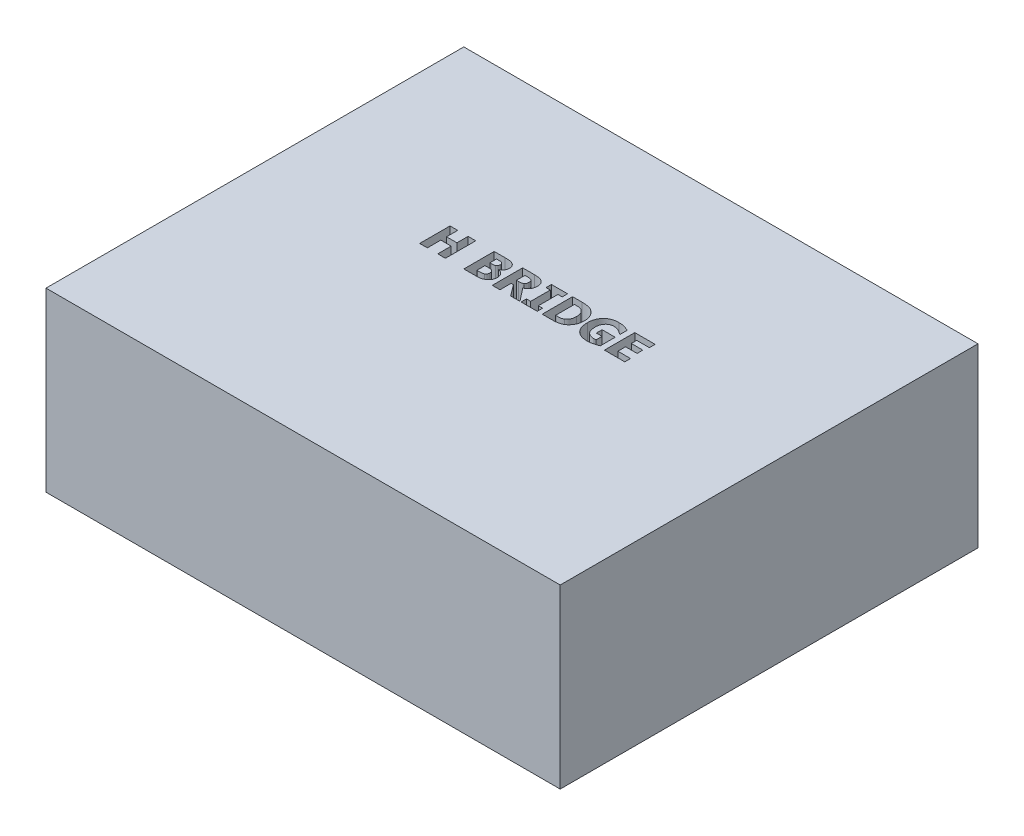
from build123d import *

# Parameters (mm, degrees)
SKETCH1_W           = 64
SKETCH1_H           = 52
BOSS_EXTRUDE1_DEPTH = 22
CUT_EXTRUDE1_DEPTH  = 5


with BuildPart() as part:
    # Sketch1 → Boss-Extrude1 (new body)
    with BuildSketch(Plane(origin=(0, 0, 0), x_dir=(1, 0, 0), z_dir=(0, 1, 0))):
        Rectangle(SKETCH1_W, SKETCH1_H)
    extrude(amount=BOSS_EXTRUDE1_DEPTH)

    # Sketch2 → Cut-Extrude1 (cut)
    # profile 1 of 7: a face of its own
    with BuildSketch(Plane(origin=(0, 22, 0), x_dir=(1, 0, 0), z_dir=(0, 1, 0))):
        Polygon((-10.357455958, 2.069627509), (-11.313535369, 2.069627509), (-11.313535369, 3.742766478), (-12.604242573, 3.742766478), (-12.604242573, 2.069627509), (-13.560321984, 2.069627509), (-13.560321984, 5.846141181), (-12.604242573, 5.846141181), (-12.604242573, 4.459826036), (-11.313535369, 4.459826036), (-11.313535369, 5.846141181), (-10.357455958, 5.846141181), align=None)
    # profile 2 of 7: a face of its own
    with BuildSketch(Plane(origin=(0, 22, 0), x_dir=(1, 0, 0), z_dir=(0, 1, 0))):
        with BuildLine():
            add(Edge.make_bspline(
                [(-5.051215229, 3.235596228), (-5.052531204, 3.189721844), (-5.055096883, 3.100283262), (-5.074311597, 2.97025612), (-5.10830409, 2.849045976), (-5.154514397, 2.736729844), (-5.212548958, 2.633772128), (-5.280221165, 2.540128014), (-5.356158117, 2.454578318), (-5.414327991, 2.406059899), (-5.443357175, 2.381847192)],
                knots=[0, 0, 0, 0, 1.130445661, 2.203963237, 3.229787093, 4.225774451, 5.190144825, 6.135328208, 7.069451278, 8, 8, 8, 8], degree=3))
            add(Edge.make_bspline(
                [(-5.443357175, 2.381847192), (-5.479174189, 2.354911476), (-5.549971715, 2.301669126), (-5.665150184, 2.2359779), (-5.784602746, 2.180856133), (-5.911948827, 2.138610859), (-6.050253744, 2.106939579), (-6.203415327, 2.085349713), (-6.373798449, 2.071846766), (-6.493024809, 2.070390938), (-6.555546427, 2.069627509)],
                knots=[0, 0, 0, 0, 0.91099212, 1.800708127, 2.691591466, 3.583856334, 4.525105797, 5.57463143, 6.728150668, 8, 8, 8, 8], degree=3))
            Line((-6.555546427, 2.069627509), (-8.062865373, 2.069627509))
            Line((-8.062865373, 2.069627509), (-8.062865373, 5.846141181))
            Line((-8.062865373, 5.846141181), (-6.727341946, 5.846141181))
            add(Edge.make_bspline(
                [(-6.727341946, 5.846141181), (-6.693729267, 5.84594937), (-6.628492719, 5.845577096), (-6.533875904, 5.844100068), (-6.44548491, 5.84183092), (-6.363544082, 5.839077432), (-6.287812437, 5.834771262), (-6.218668294, 5.828335835), (-6.15555645, 5.822910819), (-6.080117896, 5.812890663), (-5.991087544, 5.796229325), (-5.888117715, 5.767634733), (-5.788309031, 5.73073681), (-5.725167221, 5.698625414), (-5.693581083, 5.68256197)],
                knots=[0, 0, 0, 0, 1.143520417, 2.219380531, 3.219197627, 4.15154526, 5.008552699, 5.799198733, 6.513922521, 7.163213148, 8.387543574, 9.591785181, 10.795311644, 12, 12, 12, 12], degree=3))
            add(Edge.make_bspline(
                [(-5.693581083, 5.68256197), (-5.661437999, 5.663697312), (-5.598750611, 5.626906314), (-5.515026853, 5.559049282), (-5.446206202, 5.480201898), (-5.388609703, 5.393779324), (-5.344690767, 5.299143608), (-5.313183699, 5.197418861), (-5.293113569, 5.089039928), (-5.291207047, 5.014142838), (-5.290235082, 4.97595953)],
                knots=[0, 0, 0, 0, 1.041847095, 2.031873272, 2.999091578, 3.959286096, 4.928433905, 5.906626674, 6.932776715, 8, 8, 8, 8], degree=3))
            add(Edge.make_bspline(
                [(-5.290235082, 4.97595953), (-5.291618842, 4.93149973), (-5.294341721, 4.844014433), (-5.321641351, 4.717086137), (-5.364286407, 4.597057265), (-5.424691225, 4.486289112), (-5.500274809, 4.386584552), (-5.589326887, 4.300216717), (-5.692124609, 4.228761291), (-5.768401256, 4.194252072), (-5.807115513, 4.176736898)],
                knots=[0, 0, 0, 0, 1.052709469, 2.071457828, 3.062941266, 4.064024921, 5.049816461, 6.018313633, 6.994193899, 8, 8, 8, 8], degree=3))
            Line((-5.807115513, 4.176736898), (-5.807115513, 4.156569598))
            add(Edge.make_bspline(
                [(-5.807115513, 4.156569598), (-5.779103846, 4.150053372), (-5.724006925, 4.137236428), (-5.644626213, 4.110447731), (-5.569287311, 4.080297151), (-5.498324183, 4.044839507), (-5.431649665, 4.004348494), (-5.368979549, 3.959112695), (-5.311242085, 3.908367713), (-5.257069801, 3.854090596), (-5.20853296, 3.794449248), (-5.166174886, 3.729382625), (-5.130502778, 3.659237703), (-5.101258591, 3.584169303), (-5.078863858, 3.504062067), (-5.062578878, 3.419141589), (-5.052649954, 3.328950731), (-5.051701587, 3.267242474), (-5.051215229, 3.235596228)],
                knots=[0, 0, 0, 0, 1.057746791, 2.080511354, 3.079231932, 4.042133923, 4.99592611, 5.947074256, 6.882246053, 7.821672012, 8.766088789, 9.70636327, 10.673397439, 11.656829387, 12.66616828, 13.72992954, 14.835825053, 16, 16, 16, 16], degree=3))
        make_face()
        with BuildLine():
            add(Edge.make_bspline(
                [(-6.246314493, 4.795200767), (-6.246906398, 4.810681443), (-6.24811866, 4.842386913), (-6.257718309, 4.889883438), (-6.271707794, 4.938451787), (-6.292641745, 4.985889198), (-6.317917539, 5.032051031), (-6.351619402, 5.071692822), (-6.392448465, 5.104119156), (-6.423269745, 5.119649374), (-6.439024249, 5.127587749)],
                knots=[0, 0, 0, 0, 0.915395731, 1.874792295, 2.858433124, 3.90120845, 4.937405344, 5.961802946, 6.958161907, 8, 8, 8, 8], degree=3))
            add(Edge.make_bspline(
                [(-6.439024249, 5.127587749), (-6.455064342, 5.134238004), (-6.487974662, 5.147882687), (-6.541635362, 5.160659161), (-6.599324042, 5.169715682), (-6.663294049, 5.173905722), (-6.737053069, 5.174544494), (-6.824436106, 5.176482063), (-6.927520672, 5.177012491), (-7.001468014, 5.176929841), (-7.041055503, 5.176885594)],
                knots=[0, 0, 0, 0, 0.684378048, 1.404175102, 2.169995346, 2.98777272, 3.931378651, 5.081316863, 6.437491725, 8, 8, 8, 8], degree=3))
            Line((-7.041055503, 5.176885594), (-7.106785962, 5.176885594))
            Line((-7.106785962, 5.176885594), (-7.106785962, 4.364218095))
            Line((-7.106785962, 4.364218095), (-6.988022973, 4.364218095))
            add(Edge.make_bspline(
                [(-6.988022973, 4.364218095), (-6.950425732, 4.364053005), (-6.881452008, 4.363750141), (-6.787096062, 4.365616458), (-6.711142129, 4.367019496), (-6.633276691, 4.368843672), (-6.544729388, 4.382754276), (-6.480163763, 4.409354464), (-6.446493619, 4.423226121)],
                knots=[0, 0, 0, 0, 1.231390467, 2.259037774, 3.090997842, 3.719401835, 4.810697381, 6, 6, 6, 6], degree=3))
            add(Edge.make_bspline(
                [(-6.446493619, 4.423226121), (-6.428397518, 4.432537466), (-6.393724156, 4.450378638), (-6.350022519, 4.486685697), (-6.313347151, 4.526264808), (-6.288248412, 4.573286644), (-6.270245443, 4.623671428), (-6.2550702, 4.67714812), (-6.248431816, 4.735033458), (-6.247033256, 4.77477589), (-6.246314493, 4.795200767)],
                knots=[0, 0, 0, 0, 1.083723435, 2.076487952, 3.018522984, 3.947228666, 4.898232103, 5.875647137, 6.908228701, 8, 8, 8, 8], degree=3))
        make_face(mode=Mode.SUBTRACT)
        with BuildLine():
            add(Edge.make_bspline(
                [(-6.00729464, 3.250534969), (-6.008033416, 3.279732135), (-6.00943777, 3.335233625), (-6.023099608, 3.413271802), (-6.044014962, 3.482170678), (-6.076305749, 3.540748174), (-6.116982496, 3.591595619), (-6.166863841, 3.634738872), (-6.225092512, 3.672194636), (-6.268633275, 3.69016096), (-6.291130715, 3.69944413)],
                knots=[0, 0, 0, 0, 1.223025523, 2.324874161, 3.311999707, 4.227644879, 5.111309446, 6.028560024, 6.981360234, 8, 8, 8, 8], degree=3))
            add(Edge.make_bspline(
                [(-6.291130715, 3.69944413), (-6.306712278, 3.705025544), (-6.340058006, 3.716970194), (-6.395534206, 3.728290768), (-6.45900488, 3.735599285), (-6.531372955, 3.738596938), (-6.614043625, 3.740771599), (-6.708664475, 3.742212382), (-6.815977119, 3.742932788), (-6.891916904, 3.742823937), (-6.932002695, 3.742766478)],
                knots=[0, 0, 0, 0, 0.614957564, 1.316055911, 2.099415238, 2.989610622, 4.00862425, 5.175571169, 6.509088967, 8, 8, 8, 8], degree=3))
            Line((-6.932002695, 3.742766478), (-7.106785962, 3.742766478))
            Line((-7.106785962, 3.742766478), (-7.106785962, 2.738883097))
            Line((-7.106785962, 2.738883097), (-7.055994243, 2.738883097))
            add(Edge.make_bspline(
                [(-7.055994243, 2.738883097), (-7.02636585, 2.738905737), (-6.969598845, 2.738949114), (-6.887931051, 2.738652829), (-6.813239508, 2.739639985), (-6.745517038, 2.740329489), (-6.685014337, 2.741057215), (-6.631734901, 2.741880314), (-6.585659692, 2.74237682), (-6.533539972, 2.744269777), (-6.472350176, 2.7496336), (-6.400097128, 2.764106642), (-6.326841657, 2.785585825), (-6.279483532, 2.806086299), (-6.255277737, 2.816564549)],
                knots=[0, 0, 0, 0, 1.314396541, 2.518339591, 3.622929724, 4.628117177, 5.522858632, 6.307156197, 6.992056909, 7.566839726, 8.620846177, 9.712605044, 10.830861409, 12, 12, 12, 12], degree=3))
            add(Edge.make_bspline(
                [(-6.255277737, 2.816564549), (-6.234751703, 2.827168241), (-6.194952304, 2.847728499), (-6.142292354, 2.887984475), (-6.099065772, 2.935629855), (-6.065619255, 2.990290935), (-6.039322655, 3.049619413), (-6.020954485, 3.113217875), (-6.009250299, 3.180640456), (-6.007957858, 3.226831802), (-6.00729464, 3.250534969)],
                knots=[0, 0, 0, 0, 1.044175691, 2.024627102, 2.982012005, 3.938799849, 4.912493031, 5.910912324, 6.927981141, 8, 8, 8, 8], degree=3))
        make_face(mode=Mode.SUBTRACT)
    # profile 3 of 7: a face of its own
    with BuildSketch(Plane(origin=(0, 22, 0), x_dir=(1, 0, 0), z_dir=(0, 1, 0))):
        with BuildLine():
            Line((-1.083485675, 2.069627509), (-2.236009527, 2.069627509))
            Line((-2.236009527, 2.069627509), (-3.273505075, 3.455942655))
            Line((-3.273505075, 3.455942655), (-3.569292143, 3.455942655))
            Line((-3.569292143, 3.455942655), (-3.569292143, 2.069627509))
            Line((-3.569292143, 2.069627509), (-4.525371553, 2.069627509))
            Line((-4.525371553, 2.069627509), (-4.525371553, 5.846141181))
            Line((-4.525371553, 5.846141181), (-3.018052608, 5.846141181))
            add(Edge.make_bspline(
                [(-3.018052608, 5.846141181), (-2.96774983, 5.845792138), (-2.870569594, 5.84511782), (-2.729756344, 5.837677564), (-2.598958114, 5.824870991), (-2.476807647, 5.808282863), (-2.361340395, 5.78421533), (-2.251810705, 5.747512207), (-2.145946369, 5.701977743), (-2.080006715, 5.662643086), (-2.047034456, 5.642974307)],
                knots=[0, 0, 0, 0, 1.199793894, 2.317889013, 3.362092139, 4.333845176, 5.257590495, 6.170331022, 7.085098041, 8, 8, 8, 8], degree=3))
            add(Edge.make_bspline(
                [(-2.047034456, 5.642974307), (-2.014534678, 5.620879738), (-1.95037186, 5.577259447), (-1.865632745, 5.498013714), (-1.790310423, 5.411156124), (-1.725479184, 5.314710586), (-1.671546176, 5.207511249), (-1.635940814, 5.085853265), (-1.613098587, 4.9516758), (-1.610618067, 4.85754818), (-1.609329351, 4.808645633)],
                knots=[0, 0, 0, 0, 0.953924463, 1.883289238, 2.810108911, 3.743307755, 4.701369409, 5.714009315, 6.812348952, 8, 8, 8, 8], degree=3))
            add(Edge.make_bspline(
                [(-1.609329351, 4.808645633), (-1.609780154, 4.773261606), (-1.61066135, 4.704095623), (-1.621117485, 4.603147624), (-1.635355457, 4.507139724), (-1.657141473, 4.416181079), (-1.685562853, 4.330661426), (-1.719189258, 4.249694847), (-1.759554386, 4.17420147), (-1.821762027, 4.080643138), (-1.91173094, 3.972786423), (-2.03711953, 3.858187284), (-2.178184416, 3.755634516), (-2.282771761, 3.70159971), (-2.336099091, 3.67404827)],
                knots=[0, 0, 0, 0, 0.888936574, 1.737625011, 2.548320823, 3.326937543, 4.084834997, 4.811205944, 5.527889522, 6.232533624, 7.632244915, 9.044932759, 10.493260882, 12, 12, 12, 12], degree=3))
            Line((-2.336099091, 3.67404827), (-1.083485675, 2.069627509))
        make_face()
        with BuildLine():
            add(Edge.make_bspline(
                [(-2.565408762, 4.699592826), (-2.56577916, 4.723300454), (-2.56649667, 4.769225325), (-2.577832449, 4.835420211), (-2.593268554, 4.89709368), (-2.617920063, 4.952855291), (-2.648275322, 5.004421677), (-2.689430572, 5.048476547), (-2.739144027, 5.086910795), (-2.777164391, 5.106292722), (-2.796959244, 5.116383694)],
                knots=[0, 0, 0, 0, 1.119761289, 2.169128442, 3.168954851, 4.118408773, 5.043447249, 5.985348535, 6.951095516, 8, 8, 8, 8], degree=3))
            add(Edge.make_bspline(
                [(-2.796959244, 5.116383694), (-2.827517665, 5.128169117), (-2.890460471, 5.152444182), (-2.97629344, 5.165953606), (-3.05063106, 5.171043709), (-3.113852473, 5.175373964), (-3.183623129, 5.176186972), (-3.232424787, 5.176646482), (-3.257819397, 5.176885594)],
                knots=[0, 0, 0, 0, 1.256441546, 2.587959541, 3.317795867, 4.123378269, 5.023474215, 6, 6, 6, 6], degree=3))
            Line((-3.257819397, 5.176885594), (-3.569292143, 5.176885594))
            Line((-3.569292143, 5.176885594), (-3.569292143, 4.125198242))
            Line((-3.569292143, 4.125198242), (-3.30263562, 4.125198242))
            add(Edge.make_bspline(
                [(-3.30263562, 4.125198242), (-3.271510668, 4.125490574), (-3.211715482, 4.126052182), (-3.125429163, 4.130149975), (-3.046773924, 4.138805101), (-2.974334293, 4.148352244), (-2.908214217, 4.164518401), (-2.847685847, 4.188196758), (-2.791468938, 4.217582671), (-2.758744469, 4.243660549), (-2.74243284, 4.256659161)],
                knots=[0, 0, 0, 0, 1.270824428, 2.441423287, 3.524730841, 4.500863784, 5.422940595, 6.295084937, 7.15017896, 8, 8, 8, 8], degree=3))
            add(Edge.make_bspline(
                [(-2.74243284, 4.256659161), (-2.72816023, 4.269015704), (-2.699723644, 4.293634738), (-2.663367379, 4.336184571), (-2.633132693, 4.382560635), (-2.607911644, 4.432771008), (-2.588203642, 4.48889427), (-2.575269097, 4.552454245), (-2.567070674, 4.623440392), (-2.565979837, 4.673424923), (-2.565408762, 4.699592826)],
                knots=[0, 0, 0, 0, 0.914359853, 1.821760216, 2.702345359, 3.593131941, 4.539985656, 5.57704332, 6.731533712, 8, 8, 8, 8], degree=3))
        make_face(mode=Mode.SUBTRACT)
    # profile 4 of 7: a face of its own
    with BuildSketch(Plane(origin=(0, 22, 0), x_dir=(1, 0, 0), z_dir=(0, 1, 0))):
        Polygon((1.067692999, 2.069627509), (-0.940073764, 2.069627509), (-0.940073764, 2.738883097), (-0.414230088, 2.738883097), (-0.414230088, 5.176885594), (-0.940073764, 5.176885594), (-0.940073764, 5.846141181), (1.067692999, 5.846141181), (1.067692999, 5.176885594), (0.541849323, 5.176885594), (0.541849323, 2.738883097), (1.067692999, 2.738883097), align=None)
    # profile 5 of 7: a face of its own
    with BuildSketch(Plane(origin=(0, 22, 0), x_dir=(1, 0, 0), z_dir=(0, 1, 0))):
        with BuildLine():
            add(Edge.make_bspline(
                [(5.035422553, 3.95414966), (5.034651807, 3.910807379), (5.033125796, 3.824993371), (5.022587795, 3.698011369), (5.004845466, 3.574479915), (4.979057089, 3.454622997), (4.947381747, 3.337893639), (4.907241729, 3.224871038), (4.861354737, 3.114751273), (4.807201781, 3.009221791), (4.748788539, 2.908117019), (4.685516243, 2.812890974), (4.619457203, 2.723220271), (4.548955756, 2.639748687), (4.474084224, 2.563187229), (4.396511709, 2.491447357), (4.313966609, 2.427371911), (4.256580656, 2.388513505), (4.227983613, 2.369149262)],
                knots=[0, 0, 0, 0, 1.121822389, 2.221112362, 3.295660391, 4.349819622, 5.392669781, 6.424006338, 7.452176772, 8.478224285, 9.491830202, 10.473124269, 11.435960549, 12.37335562, 13.298531032, 14.206304325, 15.106150719, 16, 16, 16, 16], degree=3))
            add(Edge.make_bspline(
                [(4.227983613, 2.369149262), (4.178802623, 2.339123634), (4.081155642, 2.279508895), (3.924054238, 2.210502576), (3.761376617, 2.156543208), (3.591376738, 2.121848755), (3.416442719, 2.099219576), (3.236359809, 2.081446625), (3.050909021, 2.072170008), (2.925334039, 2.070481381), (2.861835768, 2.069627509)],
                knots=[0, 0, 0, 0, 0.973457821, 1.932763407, 2.894071884, 3.866837462, 4.861230705, 5.876345917, 6.926152624, 8, 8, 8, 8], degree=3))
            Line((2.861835768, 2.069627509), (1.689144615, 2.069627509))
            Line((1.689144615, 2.069627509), (1.689144615, 5.846141181))
            Line((1.689144615, 5.846141181), (2.851378649, 5.846141181))
            add(Edge.make_bspline(
                [(2.851378649, 5.846141181), (2.916126296, 5.845650783), (3.043705369, 5.8446845), (3.231791667, 5.834567301), (3.413683356, 5.818981123), (3.589837862, 5.797646956), (3.761248357, 5.764169485), (3.926746093, 5.711743984), (4.086622084, 5.640243998), (4.186974051, 5.580036939), (4.237693794, 5.549607177)],
                knots=[0, 0, 0, 0, 1.079902021, 2.127844083, 3.140779136, 4.124649306, 5.086536717, 6.049284413, 7.014072209, 8, 8, 8, 8], degree=3))
            add(Edge.make_bspline(
                [(4.237693794, 5.549607177), (4.267845072, 5.529325477), (4.328010644, 5.488854221), (4.413403743, 5.421234467), (4.493733376, 5.348110812), (4.569650906, 5.270306042), (4.639878782, 5.186898445), (4.705860557, 5.09885113), (4.766243411, 5.004987766), (4.822381067, 4.906752662), (4.872526512, 4.803198318), (4.916611327, 4.695313211), (4.953397953, 4.582436756), (4.982708038, 4.465253213), (5.007295455, 4.343993706), (5.022931737, 4.217881081), (5.03419006, 4.087558115), (5.035008282, 3.998991517), (5.035422553, 3.95414966)],
                knots=[0, 0, 0, 0, 0.935560749, 1.86687108, 2.801970286, 3.731535202, 4.664191023, 5.608042752, 6.563109811, 7.536574956, 8.520207772, 9.523969371, 10.535788198, 11.574633174, 12.633450416, 13.71986561, 14.845552802, 16, 16, 16, 16], degree=3))
        make_face()
        with BuildLine():
            add(Edge.make_bspline(
                [(4.079343142, 3.960125157), (4.077731368, 4.019701796), (4.074622881, 4.134602053), (4.05179858, 4.300662118), (4.011509391, 4.452797748), (3.964608193, 4.569919914), (3.920047891, 4.656393312), (3.881249236, 4.716295112), (3.839477408, 4.773700718), (3.792656094, 4.827119301), (3.741236101, 4.876522404), (3.686676437, 4.923440764), (3.626935575, 4.965798415), (3.584552654, 4.990937015), (3.563209648, 5.003596201)],
                knots=[0, 0, 0, 0, 1.750384853, 3.375814294, 4.912618378, 6.363557404, 7.073665802, 7.767764976, 8.458424072, 9.158359342, 9.851648351, 10.552347909, 11.270997694, 12, 12, 12, 12], degree=3))
            add(Edge.make_bspline(
                [(3.563209648, 5.003596201), (3.531477318, 5.020171148), (3.468638543, 5.052994121), (3.368430329, 5.08625017), (3.266816292, 5.11086091), (3.161004547, 5.119664949), (3.049835967, 5.123090538), (2.929835882, 5.127573108), (2.799591693, 5.128376127), (2.709211104, 5.128840913), (2.662403578, 5.129081623)],
                knots=[0, 0, 0, 0, 0.931672598, 1.844969007, 2.743879701, 3.650511313, 4.605290892, 5.644149072, 6.779919967, 8, 8, 8, 8], degree=3))
            Line((2.662403578, 5.129081623), (2.645224026, 5.129081623))
            Line((2.645224026, 5.129081623), (2.645224026, 2.786687067))
            Line((2.645224026, 2.786687067), (2.662403578, 2.786687067))
            add(Edge.make_bspline(
                [(2.662403578, 2.786687067), (2.712947892, 2.786797301), (2.810058157, 2.787009092), (2.949482344, 2.789519581), (3.07650109, 2.792218849), (3.192970922, 2.796550383), (3.302924273, 2.80776572), (3.408141612, 2.835688539), (3.511199783, 2.875771875), (3.575363828, 2.913257912), (3.60802587, 2.93233979)],
                knots=[0, 0, 0, 0, 1.248445623, 2.398625619, 3.444398636, 4.386318194, 5.278054247, 6.167050445, 7.066956017, 8, 8, 8, 8], degree=3))
            add(Edge.make_bspline(
                [(3.60802587, 2.93233979), (3.644950447, 2.957944765), (3.718387967, 3.008869272), (3.814043663, 3.103833734), (3.895093585, 3.212658891), (3.963131887, 3.334719286), (4.015169582, 3.471699123), (4.052946359, 3.622050391), (4.075479173, 3.78665626), (4.078021578, 3.900794882), (4.079343142, 3.960125157)],
                knots=[0, 0, 0, 0, 0.910460996, 1.810772236, 2.720195286, 3.656503622, 4.636985059, 5.684687075, 6.796479684, 8, 8, 8, 8], degree=3))
        make_face(mode=Mode.SUBTRACT)
    # profile 6 of 7: a face of its own
    with BuildSketch(Plane(origin=(0, 22, 0), x_dir=(1, 0, 0), z_dir=(0, 1, 0))):
        with BuildLine():
            add(Edge.make_bspline(
                [(8.716328283, 2.267565825), (8.672912801, 2.250455826), (8.580921683, 2.214202217), (8.431720183, 2.165863513), (8.264949195, 2.116454248), (8.08342041, 2.068494308), (7.893440386, 2.027086773), (7.701552333, 1.995962857), (7.510886468, 1.977590664), (7.384079707, 1.975205249), (7.321049894, 1.974019568)],
                knots=[0, 0, 0, 0, 0.780989599, 1.654803845, 2.624071041, 3.692593391, 4.796992972, 5.877542457, 6.945023884, 8, 8, 8, 8], degree=3))
            add(Edge.make_bspline(
                [(7.321049894, 1.974019568), (7.25027312, 1.975589477), (7.112282969, 1.978650255), (6.910449835, 2.002755962), (6.719908763, 2.043608533), (6.540089946, 2.100708674), (6.371123147, 2.172769333), (6.213741795, 2.262895859), (6.06671838, 2.36812841), (5.932121671, 2.490369172), (5.810839441, 2.627144986), (5.704902402, 2.778136511), (5.615640365, 2.942858158), (5.543132648, 3.12134238), (5.486519548, 3.313005812), (5.446451728, 3.518301731), (5.422456728, 3.736965553), (5.419416055, 3.887361152), (5.417854317, 3.964606779)],
                knots=[0, 0, 0, 0, 1.087868783, 2.120966666, 3.119463563, 4.079411369, 5.017256861, 5.937821536, 6.861999817, 7.79148942, 8.726980861, 9.666761473, 10.620776839, 11.600970159, 12.623118583, 13.688314141, 14.812680534, 16, 16, 16, 16], degree=3))
            add(Edge.make_bspline(
                [(5.417854317, 3.964606779), (5.419433543, 4.037620737), (5.422514629, 4.180071705), (5.446503432, 4.388372305), (5.487593805, 4.585299243), (5.544386002, 4.7714025), (5.616663212, 4.946839045), (5.707064053, 5.110191647), (5.812782434, 5.262956694), (5.934727681, 5.403218579), (6.07011074, 5.530008236), (6.218346727, 5.641055726), (6.37939236, 5.733756673), (6.551839976, 5.81026802), (6.736475365, 5.869349637), (6.932569295, 5.911540835), (7.140837287, 5.93753842), (7.283625128, 5.94032108), (7.356902871, 5.941749122)],
                knots=[0, 0, 0, 0, 1.119655006, 2.184458187, 3.210491154, 4.200989499, 5.16476007, 6.115015289, 7.05884974, 8.009020555, 8.96004274, 9.898671669, 10.843139352, 11.803924629, 12.786930566, 13.810822368, 14.876529016, 16, 16, 16, 16], degree=3))
            add(Edge.make_bspline(
                [(7.356902871, 5.941749122), (7.394747544, 5.941371698), (7.468712374, 5.940634047), (7.577125596, 5.937528369), (7.679880853, 5.929224867), (7.777452176, 5.921246759), (7.869261064, 5.907958958), (7.95584242, 5.893509572), (8.036898231, 5.875635952), (8.138178118, 5.847024408), (8.262591226, 5.806336908), (8.41209445, 5.750213721), (8.563923122, 5.685769835), (8.664947694, 5.638092311), (8.716328283, 5.613843762)],
                knots=[0, 0, 0, 0, 0.96377752, 1.883637369, 2.760864299, 3.588580347, 4.375824843, 5.122126748, 5.823559954, 6.488060961, 7.801317481, 9.155561891, 10.553333086, 12, 12, 12, 12], degree=3))
            Line((8.716328283, 5.613843762), (8.716328283, 4.746649859))
            Line((8.716328283, 4.746649859), (8.631177461, 4.746649859))
            add(Edge.make_bspline(
                [(8.631177461, 4.746649859), (8.618707241, 4.755583919), (8.591177572, 4.775307044), (8.546906881, 4.808080371), (8.494898379, 4.845724227), (8.416923257, 4.901123467), (8.317944808, 4.971138943), (8.233484888, 5.018221504), (8.192725419, 5.040943053)],
                knots=[0, 0, 0, 0, 0.522454513, 1.153387776, 1.875963891, 2.708928475, 4.411763488, 6, 6, 6, 6], degree=3))
            add(Edge.make_bspline(
                [(8.192725419, 5.040943053), (8.168730403, 5.053467022), (8.119512121, 5.079156034), (8.040937907, 5.112312355), (7.957034482, 5.142748312), (7.868806853, 5.171234377), (7.776471632, 5.195386929), (7.680619819, 5.212668132), (7.581923626, 5.222173229), (7.515272416, 5.223845676), (7.481641357, 5.224689564)],
                knots=[0, 0, 0, 0, 0.875569801, 1.795958083, 2.756888549, 3.763351312, 4.795132841, 5.842927426, 6.91157813, 8, 8, 8, 8], degree=3))
            add(Edge.make_bspline(
                [(7.481641357, 5.224689564), (7.442495203, 5.224006515), (7.365644803, 5.222665577), (7.253487579, 5.206892817), (7.146210864, 5.183463257), (7.044638141, 5.148906867), (6.947977699, 5.104771137), (6.857440407, 5.04931163), (6.770330362, 4.985668088), (6.718902697, 4.934586769), (6.692875843, 4.908735197)],
                knots=[0, 0, 0, 0, 1.07376491, 2.10797884, 3.102783072, 4.083972158, 5.047217519, 6.013005229, 6.994408504, 8, 8, 8, 8], degree=3))
            add(Edge.make_bspline(
                [(6.692875843, 4.908735197), (6.669045022, 4.881624976), (6.62052164, 4.826424209), (6.559161939, 4.731981337), (6.504143456, 4.628115516), (6.457212242, 4.513937421), (6.419837472, 4.389386539), (6.393390799, 4.255071197), (6.376485421, 4.111188575), (6.374801012, 4.011962533), (6.373933727, 3.960872094)],
                knots=[0, 0, 0, 0, 0.845135156, 1.72083099, 2.631963299, 3.597631237, 4.609426272, 5.675016454, 6.802890564, 8, 8, 8, 8], degree=3))
            add(Edge.make_bspline(
                [(6.373933727, 3.960872094), (6.374931042, 3.906310878), (6.376856809, 3.800955732), (6.391781123, 3.648348214), (6.416895796, 3.506925925), (6.452010364, 3.376166512), (6.496198651, 3.256056874), (6.552043126, 3.147318156), (6.617847366, 3.049605826), (6.693985526, 2.963113879), (6.778736757, 2.887425438), (6.871300789, 2.822417122), (6.970520846, 2.766153171), (7.078055379, 2.722186986), (7.191900439, 2.685366219), (7.313783641, 2.661603769), (7.442652805, 2.646200747), (7.531140694, 2.64426664), (7.576502361, 2.643275156)],
                knots=[0, 0, 0, 0, 1.285666435, 2.482561544, 3.609344436, 4.66690169, 5.669562127, 6.619537906, 7.54066181, 8.438734568, 9.328023629, 10.212031738, 11.099964733, 12.009900977, 12.945193997, 13.915270765, 14.931302417, 16, 16, 16, 16], degree=3))
            add(Edge.make_bspline(
                [(7.576502361, 2.643275156), (7.594428423, 2.643514297), (7.633023256, 2.644029169), (7.692327444, 2.645030368), (7.751586417, 2.648826795), (7.790131991, 2.652175413), (7.808052843, 2.653732274)],
                knots=[0, 0, 0, 0, 0.927831663, 1.997622683, 3.06904206, 4, 4, 4, 4], degree=3))
            Line((7.808052843, 2.653732274), (7.808052843, 3.408138684))
            Line((7.808052843, 3.408138684), (7.090993285, 3.408138684))
            Line((7.090993285, 3.408138684), (7.090993285, 4.125198242))
            Line((7.090993285, 4.125198242), (8.716328283, 4.125198242))
            Line((8.716328283, 4.125198242), (8.716328283, 2.267565825))
        make_face()
    # profile 7 of 7: a face of its own
    with BuildSketch(Plane(origin=(0, 22, 0), x_dir=(1, 0, 0), z_dir=(0, 1, 0))):
        Polygon((9.433387841, 2.069627509), (9.433387841, 5.846141181), (11.966998279, 5.846141181), (11.966998279, 5.129081623), (10.389467252, 5.129081623), (10.389467252, 4.459826036), (11.823586368, 4.459826036), (11.823586368, 3.742766478), (10.389467252, 3.742766478), (10.389467252, 2.786687067), (11.966998279, 2.786687067), (11.966998279, 2.069627509), align=None)
    extrude(amount=-CUT_EXTRUDE1_DEPTH, mode=Mode.SUBTRACT)


solid = part.part
